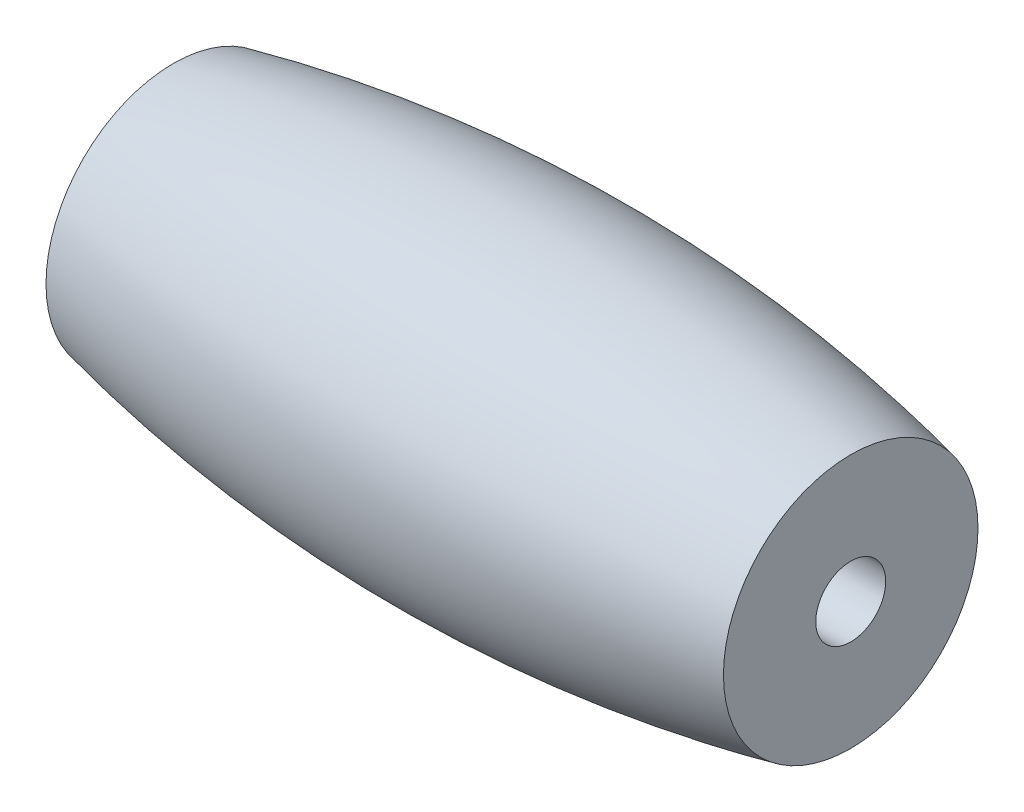
from build123d import *


with BuildPart() as part:
    # Profile → Roller (revolve)
    with BuildSketch(Plane.XY, mode=Mode.PRIVATE) as roller_sk:
        with BuildLine():
            Line((-15.5, 1.6), (15.5, 1.6))
            Line((15.5, 1.6), (15.5, 5.823724839))
            ThreePointArc((15.5, 5.823724839), (0, 7.5), (-15.5, 5.823724839))
            Line((-15.5, 5.823724839), (-15.5, 1.6))
        make_face()
    revolve(roller_sk.sketch.rotate(Axis((-31, 0, 0), (1, 0, 0)), 90), axis=Axis((-31, 0, 0), (1, 0, 0)))


solid = part.part
